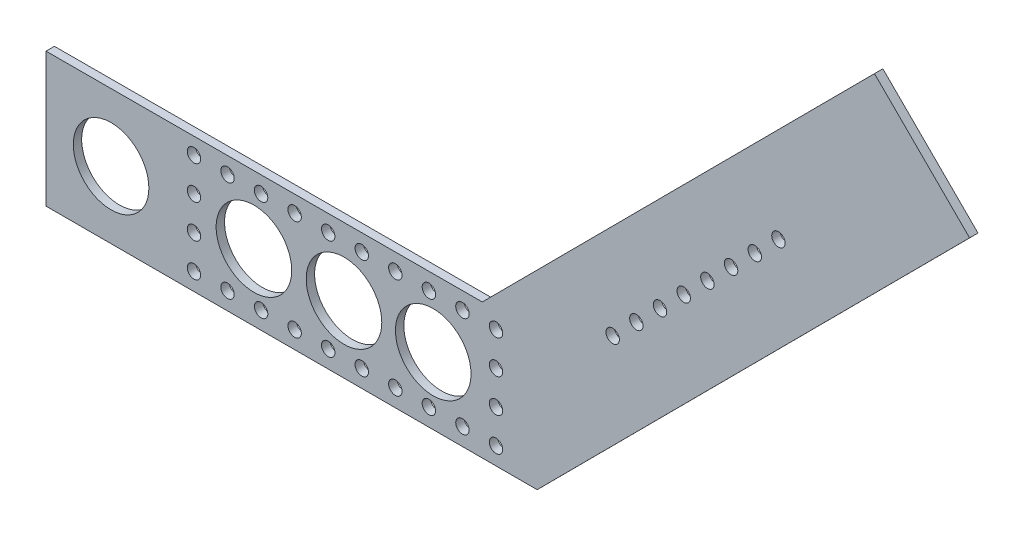
from build123d import *

# Parameters (mm, degrees)
SKETCH2_R           = 2.54
SKETCH2_R_2         = 14.3002
BOSS_EXTRUDE1_DEPTH = 3.175


with BuildPart() as part:
    # Sketch2 → Boss-Extrude1 (new body)
    with BuildSketch(Plane.XY):
        Polygon((-77.453506494, 2.582095372), (-77.453506494, -48.217904628), (108.404918235, -48.217904628), (272.064065773, 116.132232758), (236.067449331, 151.977505873), (87.646493506, 2.929897795), align=None)
        with Locations((-21.461195034, -3.501292029)):
            Circle(SKETCH2_R, mode=Mode.SUBTRACT)
        with Locations((-21.461195034, -16.201292029)):
            Circle(SKETCH2_R, mode=Mode.SUBTRACT)
        with Locations((-21.461195034, -28.901292029)):
            Circle(SKETCH2_R, mode=Mode.SUBTRACT)
        with Locations((-21.461195034, -41.601292029)):
            Circle(SKETCH2_R, mode=Mode.SUBTRACT)
        with Locations((-8.761195034, -41.601292029)):
            Circle(SKETCH2_R, mode=Mode.SUBTRACT)
        with Locations((3.938804966, -41.601292029)):
            Circle(SKETCH2_R, mode=Mode.SUBTRACT)
        with Locations((16.638804966, -41.601292029)):
            Circle(SKETCH2_R, mode=Mode.SUBTRACT)
        with Locations((29.338804966, -41.601292029)):
            Circle(SKETCH2_R, mode=Mode.SUBTRACT)
        with Locations((42.038804966, -41.601292029)):
            Circle(SKETCH2_R, mode=Mode.SUBTRACT)
        with Locations((-8.761195034, -3.501292029)):
            Circle(SKETCH2_R, mode=Mode.SUBTRACT)
        with Locations((3.938804966, -3.501292029)):
            Circle(SKETCH2_R, mode=Mode.SUBTRACT)
        with Locations((16.638804966, -3.501292029)):
            Circle(SKETCH2_R, mode=Mode.SUBTRACT)
        with Locations((29.338804966, -3.501292029)):
            Circle(SKETCH2_R, mode=Mode.SUBTRACT)
        with Locations((42.038804966, -3.501292029)):
            Circle(SKETCH2_R, mode=Mode.SUBTRACT)
        with Locations((54.738804966, -3.501292029)):
            Circle(SKETCH2_R, mode=Mode.SUBTRACT)
        with Locations((67.438804966, -3.501292029)):
            Circle(SKETCH2_R, mode=Mode.SUBTRACT)
        with Locations((80.138804966, -3.501292029)):
            Circle(SKETCH2_R, mode=Mode.SUBTRACT)
        with Locations((92.838804966, -3.501292029)):
            Circle(SKETCH2_R, mode=Mode.SUBTRACT)
        with Locations((92.838804966, -16.201292029)):
            Circle(SKETCH2_R, mode=Mode.SUBTRACT)
        with Locations((92.838804966, -28.901292029)):
            Circle(SKETCH2_R, mode=Mode.SUBTRACT)
        with Locations((54.738804966, -41.601292029)):
            Circle(SKETCH2_R, mode=Mode.SUBTRACT)
        with Locations((67.438804966, -41.601292029)):
            Circle(SKETCH2_R, mode=Mode.SUBTRACT)
        with Locations((80.138804966, -41.601292029)):
            Circle(SKETCH2_R, mode=Mode.SUBTRACT)
        with Locations((92.838804966, -41.601292029)):
            Circle(SKETCH2_R, mode=Mode.SUBTRACT)
        with Locations((69.080846726, -22.817904628)):
            Circle(SKETCH2_R_2, mode=Mode.SUBTRACT)
        with Locations((35.310660441, -22.817904628)):
            Circle(SKETCH2_R_2, mode=Mode.SUBTRACT)
        with Locations((1.237019836, -22.817904628)):
            Circle(SKETCH2_R_2, mode=Mode.SUBTRACT)
        with Locations((-52.827339559, -22.817904628)):
            Circle(SKETCH2_R_2, mode=Mode.SUBTRACT)
        with Locations((136.992213353, 16.487025642)):
            Circle(SKETCH2_R, mode=Mode.SUBTRACT)
        with Locations((145.953531631, 25.486179753)):
            Circle(SKETCH2_R, mode=Mode.SUBTRACT)
        with Locations((154.91484991, 34.485333864)):
            Circle(SKETCH2_R, mode=Mode.SUBTRACT)
        with Locations((163.876168189, 43.484487974)):
            Circle(SKETCH2_R, mode=Mode.SUBTRACT)
        with Locations((172.837486468, 52.483642085)):
            Circle(SKETCH2_R, mode=Mode.SUBTRACT)
        with Locations((181.798804747, 61.482796195)):
            Circle(SKETCH2_R, mode=Mode.SUBTRACT)
        with Locations((190.760123026, 70.481950306)):
            Circle(SKETCH2_R, mode=Mode.SUBTRACT)
        with Locations((199.721441305, 79.481104416)):
            Circle(SKETCH2_R, mode=Mode.SUBTRACT)
    extrude(amount=BOSS_EXTRUDE1_DEPTH)


solid = part.part
